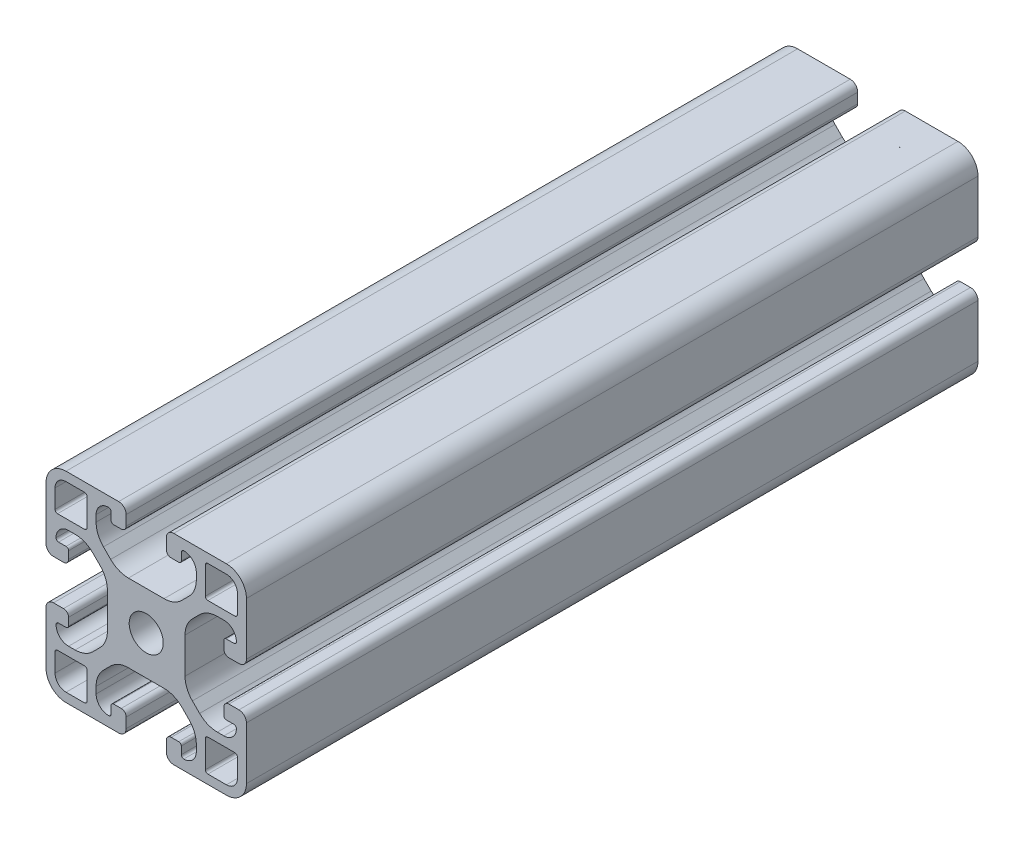
from build123d import *

# Parameters (mm, degrees)
ESQUISSE1_R        = 3.4
BOSS_EXTRU_1_DEPTH = 146


with BuildPart() as part:
    # Esquisse1 → Boss.-Extru.1 (new body)
    with BuildSketch(Plane(origin=(0, 0, -30), x_dir=(-1, 0, 0), z_dir=(0, 0, -1))):
        with BuildLine():
            Line((-4.5, 15), (-4.5, 13.5))
            ThreePointArc((-4.5, 13.5), (-4.353553391, 13.146446609), (-4, 13))
            Line((-4, 13), (-2.5, 13))
            ThreePointArc((-2.5, 13), (-2.146446609, 12.853553391), (-2, 12.5))
            ThreePointArc((-2, 12.5), (-2.732233047, 10.732233047), (-4.5, 10))
            Line((-4.5, 10), (-5.807611845, 10))
            ThreePointArc((-5.807611845, 10), (-7.721029006, 10.380602337), (-9.343145751, 11.464466094))
            Line((-9.343145751, 11.464466094), (-10.785533906, 12.906854249))
            ThreePointArc((-10.785533906, 12.906854249), (-11.869397663, 14.528970994), (-12.25, 16.442388155))
            Line((-12.25, 16.442388155), (-12.25, 23.557611845))
            ThreePointArc((-12.25, 23.557611845), (-11.869397663, 25.471029006), (-10.785533906, 27.093145751))
            Line((-10.785533906, 27.093145751), (-9.343145751, 28.535533906))
            ThreePointArc((-9.343145751, 28.535533906), (-7.721029006, 29.619397663), (-5.807611845, 30))
            Line((-5.807611845, 30), (-4.5, 30))
            ThreePointArc((-4.5, 30), (-2.732233047, 29.267766953), (-2, 27.5))
            ThreePointArc((-2, 27.5), (-2.146446609, 27.146446609), (-2.5, 27))
            Line((-2.5, 27), (-4, 27))
            ThreePointArc((-4, 27), (-4.353553391, 26.853553391), (-4.5, 26.5))
            Line((-4.5, 26.5), (-4.5, 25))
            ThreePointArc((-4.5, 25), (-4.207106781, 24.292893219), (-3.5, 24))
            Line((-3.5, 24), (-1.5, 24))
            ThreePointArc((-1.5, 24), (-0.439339828, 24.439339828), (0, 25.5))
            Line((0, 25.5), (0, 36))
            ThreePointArc((0, 36), (-1.171572875, 38.828427125), (-4, 40))
            Line((-4, 40), (-14.5, 40))
            ThreePointArc((-14.5, 40), (-15.560660172, 39.560660172), (-16, 38.5))
            Line((-16, 38.5), (-16, 36.5))
            ThreePointArc((-16, 36.5), (-15.707106781, 35.792893219), (-15, 35.5))
            Line((-15, 35.5), (-13.5, 35.5))
            ThreePointArc((-13.5, 35.5), (-13.146446609, 35.646446609), (-13, 36))
            Line((-13, 36), (-13, 37.5))
            ThreePointArc((-13, 37.5), (-12.853553391, 37.853553391), (-12.5, 38))
            ThreePointArc((-12.5, 38), (-10.732233047, 37.267766953), (-10, 35.5))
            Line((-10, 35.5), (-10, 34.192388155))
            ThreePointArc((-10, 34.192388155), (-10.380602337, 32.278970994), (-11.464466094, 30.656854249))
            Line((-11.464466094, 30.656854249), (-12.906854249, 29.214466094))
            ThreePointArc((-12.906854249, 29.214466094), (-14.528970994, 28.130602337), (-16.442388155, 27.75))
            Line((-16.442388155, 27.75), (-23.557611845, 27.75))
            ThreePointArc((-23.557611845, 27.75), (-25.471029006, 28.130602337), (-27.093145751, 29.214466094))
            Line((-27.093145751, 29.214466094), (-28.535533906, 30.656854249))
            ThreePointArc((-28.535533906, 30.656854249), (-29.619397663, 32.278970994), (-30, 34.192388155))
            Line((-30, 34.192388155), (-30, 35.5))
            ThreePointArc((-30, 35.5), (-29.267766953, 37.267766953), (-27.5, 38))
            ThreePointArc((-27.5, 38), (-27.146446609, 37.853553391), (-27, 37.5))
            Line((-27, 37.5), (-27, 36))
            ThreePointArc((-27, 36), (-26.853553391, 35.646446609), (-26.5, 35.5))
            Line((-26.5, 35.5), (-25, 35.5))
            ThreePointArc((-25, 35.5), (-24.292893219, 35.792893219), (-24, 36.5))
            Line((-24, 36.5), (-24, 38.5))
            ThreePointArc((-24, 38.5), (-24.439339828, 39.560660172), (-25.5, 40))
            Line((-25.5, 40), (-36, 40))
            ThreePointArc((-36, 40), (-38.828427125, 38.828427125), (-40, 36))
            Line((-40, 36), (-40, 25.5))
            ThreePointArc((-40, 25.5), (-39.560660172, 24.439339828), (-38.5, 24))
            Line((-38.5, 24), (-36.5, 24))
            ThreePointArc((-36.5, 24), (-35.792893219, 24.292893219), (-35.5, 25))
            Line((-35.5, 25), (-35.5, 26.5))
            ThreePointArc((-35.5, 26.5), (-35.646446609, 26.853553391), (-36, 27))
            Line((-36, 27), (-37.5, 27))
            ThreePointArc((-37.5, 27), (-37.853553391, 27.146446609), (-38, 27.5))
            ThreePointArc((-38, 27.5), (-37.267766953, 29.267766953), (-35.5, 30))
            Line((-35.5, 30), (-34.192388155, 30))
            ThreePointArc((-34.192388155, 30), (-32.278970994, 29.619397663), (-30.656854249, 28.535533906))
            Line((-30.656854249, 28.535533906), (-29.214466094, 27.093145751))
            ThreePointArc((-29.214466094, 27.093145751), (-28.130602337, 25.471029006), (-27.75, 23.557611845))
            Line((-27.75, 23.557611845), (-27.75, 16.442388155))
            ThreePointArc((-27.75, 16.442388155), (-28.130602337, 14.528970994), (-29.214466094, 12.906854249))
            Line((-29.214466094, 12.906854249), (-30.656854249, 11.464466094))
            ThreePointArc((-30.656854249, 11.464466094), (-32.278970994, 10.380602337), (-34.192388155, 10))
            Line((-34.192388155, 10), (-35.5, 10))
            ThreePointArc((-35.5, 10), (-37.267766953, 10.732233047), (-38, 12.5))
            ThreePointArc((-38, 12.5), (-37.853553391, 12.853553391), (-37.5, 13))
            Line((-37.5, 13), (-36, 13))
            ThreePointArc((-36, 13), (-35.646446609, 13.146446609), (-35.5, 13.5))
            Line((-35.5, 13.5), (-35.5, 15))
            ThreePointArc((-35.5, 15), (-35.792893219, 15.707106781), (-36.5, 16))
            Line((-36.5, 16), (-38.5, 16))
            ThreePointArc((-38.5, 16), (-39.560660172, 15.560660172), (-40, 14.5))
            Line((-40, 14.5), (-40, 4))
            ThreePointArc((-40, 4), (-38.828427125, 1.171572875), (-36, 0))
            Line((-36, 0), (-25.5, 0))
            ThreePointArc((-25.5, 0), (-24.439339828, 0.439339828), (-24, 1.5))
            Line((-24, 1.5), (-24, 3.5))
            ThreePointArc((-24, 3.5), (-24.292893219, 4.207106781), (-25, 4.5))
            Line((-25, 4.5), (-26.5, 4.5))
            ThreePointArc((-26.5, 4.5), (-26.853553391, 4.353553391), (-27, 4))
            Line((-27, 4), (-27, 2.5))
            ThreePointArc((-27, 2.5), (-27.146446609, 2.146446609), (-27.5, 2))
            ThreePointArc((-27.5, 2), (-29.267766953, 2.732233047), (-30, 4.5))
            Line((-30, 4.5), (-30, 5.807611845))
            ThreePointArc((-30, 5.807611845), (-29.619397663, 7.721029006), (-28.535533906, 9.343145751))
            Line((-28.535533906, 9.343145751), (-27.093145751, 10.785533906))
            ThreePointArc((-27.093145751, 10.785533906), (-25.471029006, 11.869397663), (-23.557611845, 12.25))
            Line((-23.557611845, 12.25), (-16.442388155, 12.25))
            ThreePointArc((-16.442388155, 12.25), (-14.528970994, 11.869397663), (-12.906854249, 10.785533906))
            Line((-12.906854249, 10.785533906), (-11.464466094, 9.343145751))
            ThreePointArc((-11.464466094, 9.343145751), (-10.380602337, 7.721029006), (-10, 5.807611845))
            Line((-10, 5.807611845), (-10, 4.5))
            ThreePointArc((-10, 4.5), (-10.732233047, 2.732233047), (-12.5, 2))
            ThreePointArc((-12.5, 2), (-12.853553391, 2.146446609), (-13, 2.5))
            Line((-13, 2.5), (-13, 4))
            ThreePointArc((-13, 4), (-13.146446609, 4.353553391), (-13.5, 4.5))
            Line((-13.5, 4.5), (-15, 4.5))
            ThreePointArc((-15, 4.5), (-15.707106781, 4.207106781), (-16, 3.5))
            Line((-16, 3.5), (-16, 1.5))
            ThreePointArc((-16, 1.5), (-15.560660172, 0.439339828), (-14.5, 0))
            Line((-14.5, 0), (-4, 0))
            ThreePointArc((-4, 0), (-1.171572875, 1.171572875), (0, 4))
            Line((0, 4), (0, 14.5))
            ThreePointArc((0, 14.5), (-0.439339828, 15.560660172), (-1.5, 16))
            Line((-1.5, 16), (-3.5, 16))
            ThreePointArc((-3.5, 16), (-4.207106781, 15.707106781), (-4.5, 15))
        make_face()
        with Locations(Location((-20, 20, 0), (0, 0, 180))):
            Circle(ESQUISSE1_R, mode=Mode.SUBTRACT)
        with BuildLine():
            Line((-4, 1.8), (-7.7, 1.8))
            ThreePointArc((-7.7, 1.8), (-8.053553391, 1.946446609), (-8.2, 2.3))
            Line((-8.2, 2.3), (-8.2, 7.7))
            ThreePointArc((-8.2, 7.7), (-8.053553391, 8.053553391), (-7.7, 8.2))
            Line((-7.7, 8.2), (-2.3, 8.2))
            ThreePointArc((-2.3, 8.2), (-1.946446609, 8.053553391), (-1.8, 7.7))
            Line((-1.8, 7.7), (-1.8, 4))
            ThreePointArc((-1.8, 4), (-2.444365081, 2.444365081), (-4, 1.8))
        make_face(mode=Mode.SUBTRACT)
        with BuildLine():
            Line((-38.2, 4), (-38.2, 7.7))
            ThreePointArc((-38.2, 7.7), (-38.053553391, 8.053553391), (-37.7, 8.2))
            Line((-37.7, 8.2), (-32.3, 8.2))
            ThreePointArc((-32.3, 8.2), (-31.946446609, 8.053553391), (-31.8, 7.7))
            Line((-31.8, 7.7), (-31.8, 2.3))
            ThreePointArc((-31.8, 2.3), (-31.946446609, 1.946446609), (-32.3, 1.8))
            Line((-32.3, 1.8), (-36, 1.8))
            ThreePointArc((-36, 1.8), (-37.555634919, 2.444365081), (-38.2, 4))
        make_face(mode=Mode.SUBTRACT)
        with BuildLine():
            Line((-36, 38.2), (-32.3, 38.2))
            ThreePointArc((-32.3, 38.2), (-31.946446609, 38.053553391), (-31.8, 37.7))
            Line((-31.8, 37.7), (-31.8, 32.3))
            ThreePointArc((-31.8, 32.3), (-31.946446609, 31.946446609), (-32.3, 31.8))
            Line((-32.3, 31.8), (-37.7, 31.8))
            ThreePointArc((-37.7, 31.8), (-38.053553391, 31.946446609), (-38.2, 32.3))
            Line((-38.2, 32.3), (-38.2, 36))
            ThreePointArc((-38.2, 36), (-37.555634919, 37.555634919), (-36, 38.2))
        make_face(mode=Mode.SUBTRACT)
        with BuildLine():
            Line((-1.8, 36), (-1.8, 32.3))
            ThreePointArc((-1.8, 32.3), (-1.946446609, 31.946446609), (-2.3, 31.8))
            Line((-2.3, 31.8), (-7.7, 31.8))
            ThreePointArc((-7.7, 31.8), (-8.053553391, 31.946446609), (-8.2, 32.3))
            Line((-8.2, 32.3), (-8.2, 37.7))
            ThreePointArc((-8.2, 37.7), (-8.053553391, 38.053553391), (-7.7, 38.2))
            Line((-7.7, 38.2), (-4, 38.2))
            ThreePointArc((-4, 38.2), (-2.444365081, 37.555634919), (-1.8, 36))
        make_face(mode=Mode.SUBTRACT)
    extrude(amount=-BOSS_EXTRU_1_DEPTH)


solid = part.part
